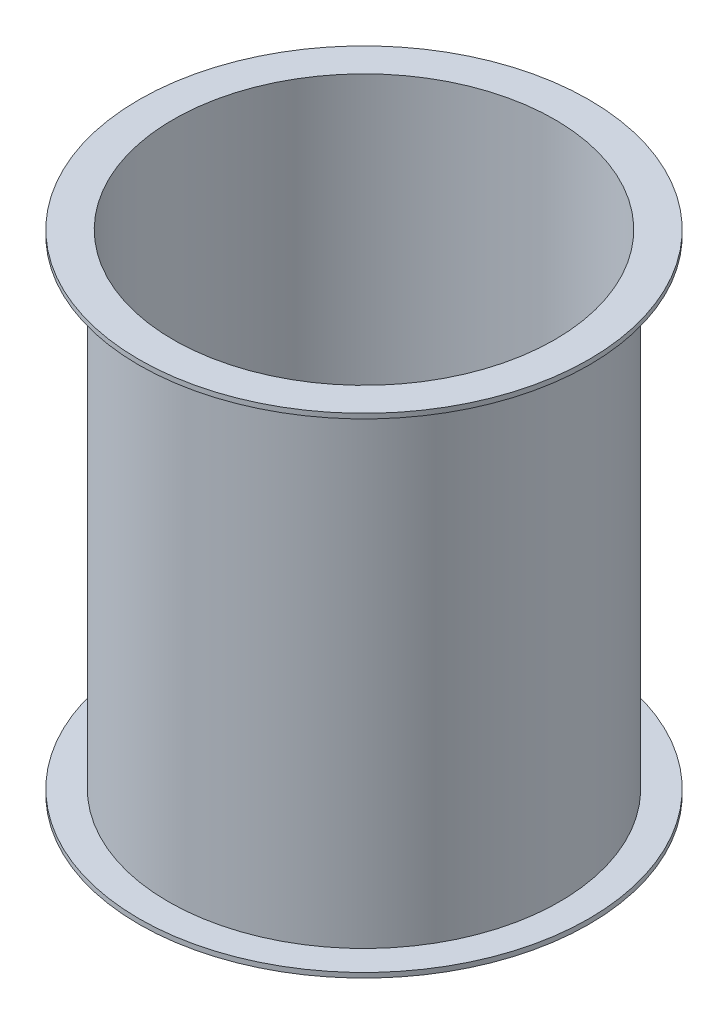
from build123d import *

# Parameters (mm, degrees)
SCHIZZO1_R                   = 40
SCHIZZO1_R_2                 = 39
ESTRUSIONE_SOTTILE1_DEPTH    = 100
ESTRUSIONE_ESTRUSIONE1_START = -1
SCHIZZO2_R                   = 46
SCHIZZO2_R_2                 = 40
ESTRUSIONE_ESTRUSIONE1_DEPTH = 1
SCHIZZO3_R                   = 46
SCHIZZO3_R_2                 = 40
ESTRUSIONE_ESTRUSIONE2_DEPTH = 1


with BuildPart() as part:
    # Schizzo1 → Estrusione-Sottile1 (new body)
    with BuildSketch(Plane(origin=(0, 0, 0), x_dir=(1, 0, 0), z_dir=(0, 1, 0))):
        Circle(SCHIZZO1_R)
        Circle(SCHIZZO1_R_2, mode=Mode.SUBTRACT)
    extrude(amount=ESTRUSIONE_SOTTILE1_DEPTH)

    # Schizzo2 → Estrusione-Estrusione1 (add)
    with BuildSketch(Plane(origin=(0, 100, 0), x_dir=(1, 0, 0), z_dir=(0, 1, 0)).offset(ESTRUSIONE_ESTRUSIONE1_START)):
        with Locations(Location((0, 0, 0), (0, 0, 270))):
            Circle(SCHIZZO2_R)
        with Locations(Location((0, 0, 0), (0, 0, 270))):
            Circle(SCHIZZO2_R_2, mode=Mode.SUBTRACT)
    extrude(amount=ESTRUSIONE_ESTRUSIONE1_DEPTH)

    # Schizzo3 → Estrusione-Estrusione2 (add)
    with BuildSketch(Plane.XZ):
        with Locations(Location((0, 0, 0), (0, 0, 90))):
            Circle(SCHIZZO3_R)
        with Locations(Location((0, 0, 0), (0, 0, 270))):
            Circle(SCHIZZO3_R_2, mode=Mode.SUBTRACT)
    extrude(amount=-ESTRUSIONE_ESTRUSIONE2_DEPTH)


solid = part.part
